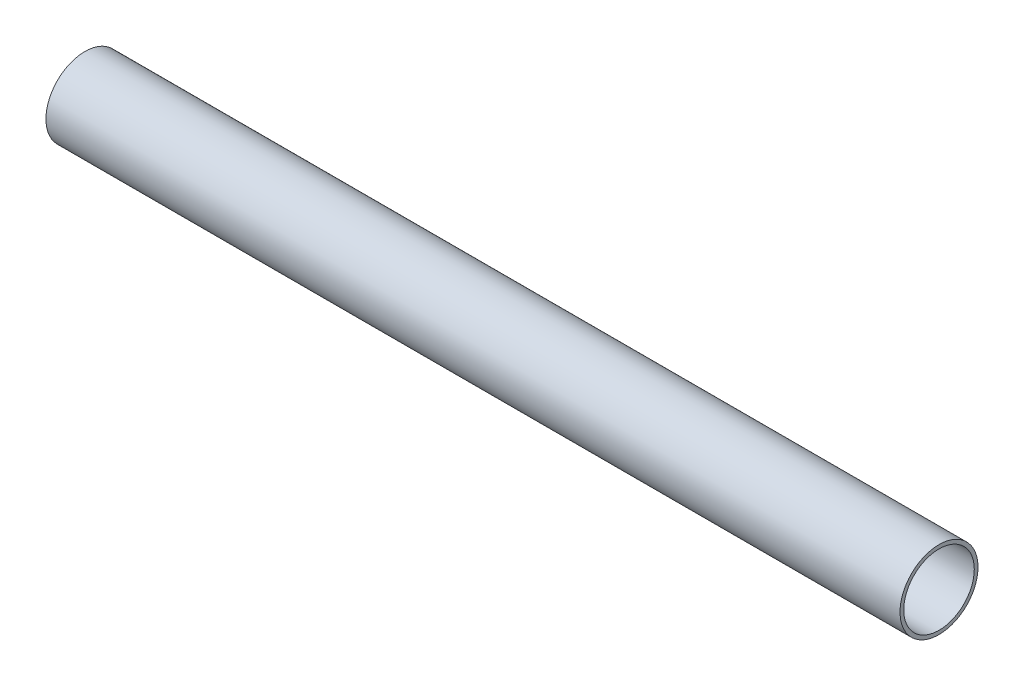
from build123d import *

# Parameters (mm, degrees)
SKIZZE1_R                       = 10.5
SKIZZE1_R_2                     = 9.5
AUFSATZ_LINEAR_AUSTRAGEN1_DEPTH = 230


with BuildPart() as part:
    # Skizze1 → Aufsatz-Linear austragen1 (new body)
    with BuildSketch(Plane(origin=(0, 0, 0), x_dir=(0, 0, -1), z_dir=(1, 0, 0))):
        Circle(SKIZZE1_R)
        Circle(SKIZZE1_R_2, mode=Mode.SUBTRACT)
    extrude(amount=AUFSATZ_LINEAR_AUSTRAGEN1_DEPTH)


solid = part.part
